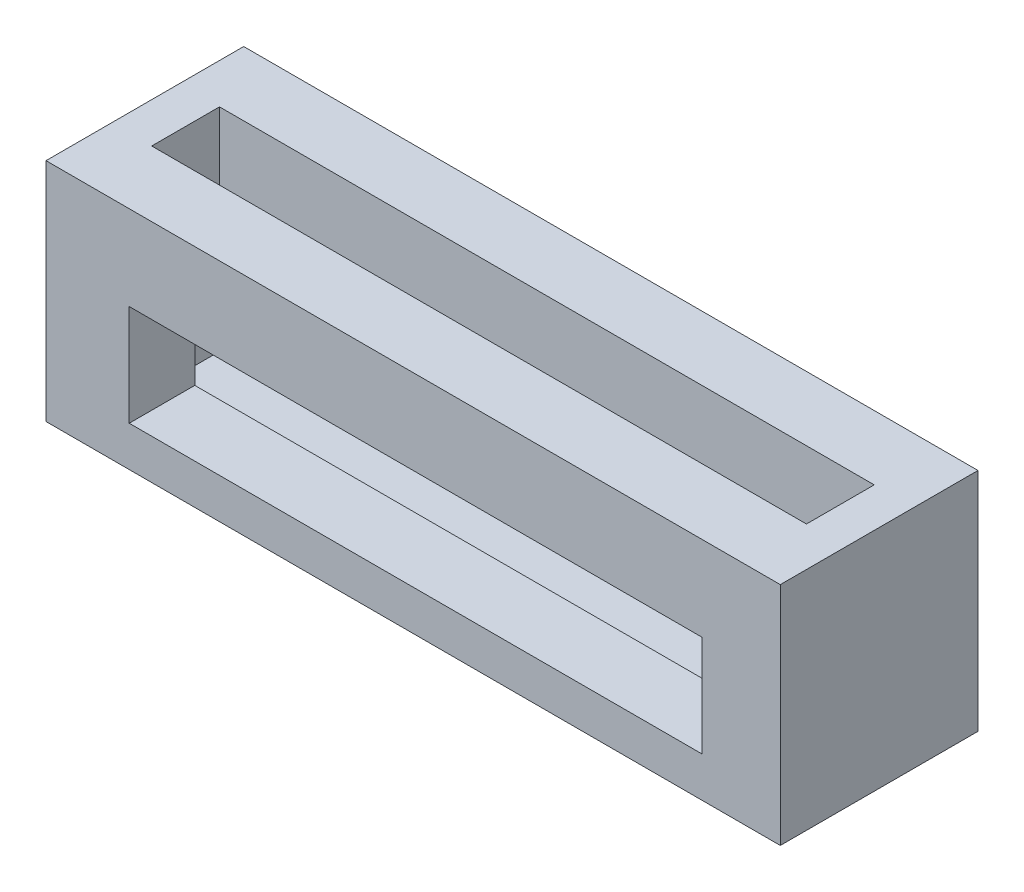
from build123d import *

# Parameters (mm, degrees)
ESQUISSE1_W                  = 260
ESQUISSE1_H                  = 70
BOSS_EXTRU_1_DEPTH           = 80
ENL_V_MAT_EXTRU_1_DEPTH      = 236
ENL_V_MAT_EXTRU_1_DEPTH_BACK = 80
ESQUISSE3_W                  = 202.727222796
ESQUISSE3_H                  = 35.788236333
ESQUISSE4_W                  = 231.827281701
ESQUISSE4_H                  = 24
ENL_V_MAT_EXTRU_2_DEPTH      = 75


with BuildPart() as part:
    # Esquisse1 → Boss.-Extru.1 (new body)
    with BuildSketch(Plane(origin=(0, 0, 0), x_dir=(1, 0, 0), z_dir=(0, 1, 0))):
        with Locations((130, -35)):
            Rectangle(ESQUISSE1_W, ESQUISSE1_H)
    extrude(amount=BOSS_EXTRU_1_DEPTH)

    # Esquisse3 → Enlèv. mat.-Extru.1 (cut, two sides: drawn at the far end of the back side and taken through both)
    with BuildSketch(Plane.XY.offset(70).offset(-ENL_V_MAT_EXTRU_1_DEPTH_BACK)):
        with Locations((130.830849274, 32.105881833)):
            Rectangle(ESQUISSE3_W, ESQUISSE3_H)
    extrude(amount=ENL_V_MAT_EXTRU_1_DEPTH + ENL_V_MAT_EXTRU_1_DEPTH_BACK, mode=Mode.SUBTRACT)

    # Esquisse4 → Enlèv. mat.-Extru.2 (cut)
    with BuildSketch(Plane(origin=(0, 80, 0), x_dir=(1, 0, 0), z_dir=(0, 1, 0))):
        with Locations((130.132710296, -34.788590838)):
            Rectangle(ESQUISSE4_W, ESQUISSE4_H)
    extrude(amount=-ENL_V_MAT_EXTRU_2_DEPTH, mode=Mode.SUBTRACT)


solid = part.part
